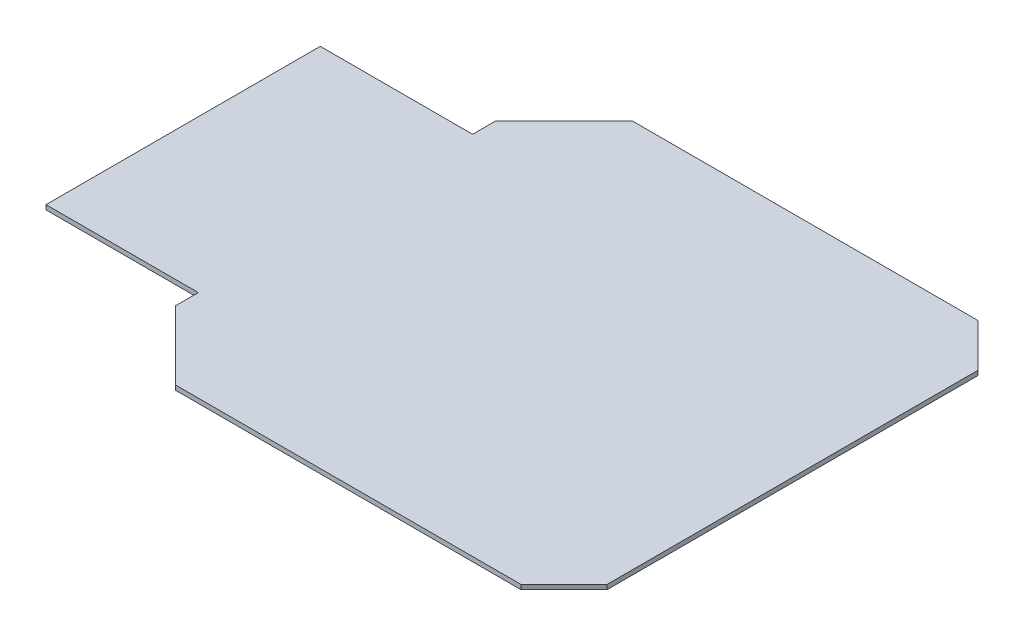
from build123d import *

# Parameters (mm, degrees)
BOSS_EXTRUDE1_DEPTH = 3
SKETCH3_W           = 102.374795857
SKETCH3_H           = 90.967021537
SKETCH3_W_2         = 153.648776174
SKETCH3_H_2         = 69.94350062
CUT_EXTRUDE2_DEPTH  = 10
CUT_EXTRUDE3_DEPTH  = 60


with BuildPart() as part:
    # Sketch1 → Boss-Extrude1 (new body)
    with BuildSketch(Plane(origin=(0, 0, 0), x_dir=(1, 0, 0), z_dir=(0, 1, 0))):
        Polygon((-245.183632637, 942.323086709), (-245.183632637, 742.323086709), (-145.183632637, 692.323086709), (126.532096115, 692.323086709), (154.816367363, 720.607357957), (154.816367363, 964.038815462), (126.532096115, 992.323086709), (-145.183632637, 992.323086709), align=None)
    extrude(amount=BOSS_EXTRUDE1_DEPTH)

    # Sketch3 → Cut-Extrude2 (cut)
    with BuildSketch(Plane(origin=(0, 3, 0), x_dir=(1, 0, 0), z_dir=(0, 1, 0))):
        with Locations((-196.371030566, 977.806597478)):
            Rectangle(SKETCH3_W, SKETCH3_H)
        with Locations((-222.008020724, 717.351336399)):
            Rectangle(SKETCH3_W_2, SKETCH3_H_2)
    extrude(amount=-CUT_EXTRUDE2_DEPTH, mode=Mode.SUBTRACT)

    # Sketch4 → Cut-Extrude3 (cut)
    with BuildSketch(Plane(origin=(0, 3, 0), x_dir=(1, 0, 0), z_dir=(0, 1, 0))):
        Polygon((-145.183632637, 947.323086709), (-100.183632637, 992.323086709), (-145.183632637, 992.323086709), align=None)
        Polygon((-100.183632637, 692.323086709), (-145.183632637, 692.323086709), (-145.183632637, 737.323086709), align=None)
    extrude(amount=-CUT_EXTRUDE3_DEPTH, mode=Mode.SUBTRACT)


solid = part.part
